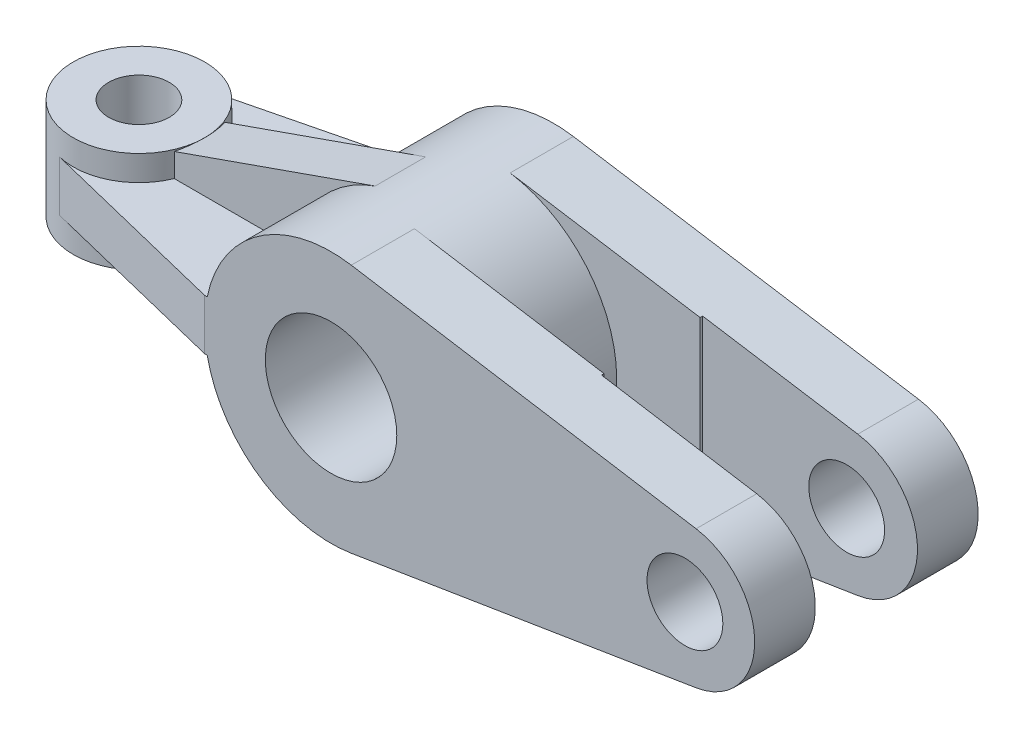
from build123d import *

# Parameters (mm, degrees)
SKETCH1_R           = 25
SKETCH1_R_2         = 13
BOSS_EXTRUDE1_DEPTH = 44
SKETCH2_R           = 7.5
BOSS_EXTRUDE2_DEPTH = 12.5
BOSS_EXTRUDE3_START = -12.5
SKETCH3_R           = 7.5
BOSS_EXTRUDE3_DEPTH = 12.5
SKETCH5_W           = 20
SKETCH5_H           = 50
CUT_EXTRUDE1_DEPTH  = 49.5
SKETCH6_R           = 13
SKETCH6_R_2         = 6
BOSS_EXTRUDE4_DEPTH = 10
BOSS_EXTRUDE5_DEPTH = 5
RIB2_REACH          = 92.36
SKETCH9_WALL_W      = 223.757348162
SKETCH9_WALL_H      = 10


with BuildPart() as part:
    # Sketch1 → Boss-Extrude1 (new body)
    with BuildSketch(Plane.XY):
        Circle(SKETCH1_R)
        Circle(SKETCH1_R_2, mode=Mode.SUBTRACT)
    extrude(amount=BOSS_EXTRUDE1_DEPTH)

    # Sketch2 → Boss-Extrude2 (add)
    with BuildSketch(Plane.XY):
        with BuildLine():
            Line((3.928571429, 24.689397047), (72.2, 13.826062346))
            ThreePointArc((72.2, 13.826062346), (84, 0), (72.2, -13.826062346))
            Line((72.2, -13.826062346), (3.928571429, -24.689397047))
            ThreePointArc((3.928571429, -24.689397047), (25, 0), (3.928571429, 24.689397047))
        make_face()
        with Locations((70, 0)):
            Circle(SKETCH2_R, mode=Mode.SUBTRACT)
    extrude(amount=BOSS_EXTRUDE2_DEPTH)

    # Sketch3 → Boss-Extrude3 (add)
    with BuildSketch(Plane.XY.offset(44).offset(BOSS_EXTRUDE3_START)):
        with BuildLine():
            Line((3.999424901, 24.678018568), (72.207940153, 13.623855788))
            ThreePointArc((72.207940153, 13.623855788), (83.801610277, 0), (72.207940153, -13.623855788))
            Line((72.207940153, -13.623855788), (3.999424901, -24.678018568))
            ThreePointArc((3.999424901, -24.678018568), (25, 0), (3.999424901, 24.678018568))
        make_face()
        with Locations((70, 0)):
            Circle(SKETCH3_R, mode=Mode.SUBTRACT)
    extrude(amount=BOSS_EXTRUDE3_DEPTH)

    # Sketch5 → Cut-Extrude1 (cut)
    with BuildSketch(Plane(origin=(91, 0, 0), x_dir=(0, 0, -1), z_dir=(1, 0, 0))):
        with Locations((-22, 0)):
            Rectangle(SKETCH5_W, SKETCH5_H)
    extrude(amount=-CUT_EXTRUDE1_DEPTH, mode=Mode.SUBTRACT)



with BuildPart() as body_2:
    # Sketch6 → Boss-Extrude4 (new, symmetric)
    with BuildSketch(Plane(origin=(0, 0, 0), x_dir=(1, 0, 0), z_dir=(0, 1, 0))):
        with Locations(Location((-60, -22, 0), (0, 0, 270))):
            Circle(SKETCH6_R)
        with Locations(Location((-60, -22, 0), (0, 0, 270))):
            Circle(SKETCH6_R_2, mode=Mode.SUBTRACT)
    extrude(amount=BOSS_EXTRUDE4_DEPTH, both=True)


with BuildPart() as part_1:
    add(part.part)

    add(body_2.part)  # Boss-Extrude5 merges body 2
    # Sketch8 → Boss-Extrude5 (add, symmetric)
    with BuildSketch(Plane(origin=(0, 0, 0), x_dir=(1, 0, 0), z_dir=(0, 1, 0))):
        with BuildLine():
            Line((-63.106173464, -9.376542216), (-25, 0))
            Line((-25, 0), (-21.363564358, 0))
            Line((-21.363564358, 0), (-21.363564358, -44))
            Line((-21.363564358, -44), (-25, -44))
            Line((-25, -44), (-63.106173464, -34.623457784))
            ThreePointArc((-63.106173464, -34.623457784), (-47, -22), (-63.106173464, -9.376542216))
        make_face()
    extrude(amount=BOSS_EXTRUDE5_DEPTH, both=True)

    # Sketch9 wall → Rib2 (add, up to next)
    with BuildSketch(Plane(origin=(-27.639423503, 16.794709537, 22), x_dir=(0.943576762972, 0.331153880211, 0), z_dir=(-0.331153880211, 0.943576762972, 0)), mode=Mode.PRIVATE) as rib2_sk1:
        Rectangle(SKETCH9_WALL_W, SKETCH9_WALL_H)
    rib2_tool1 = extrude(rib2_sk1.sketch, amount=-RIB2_REACH, mode=Mode.PRIVATE) - part_1.part
    add(rib2_tool1.solids().sort_by_distance((-27.639423503, 16.794709537, 22))[0])


solid = part_1.part
